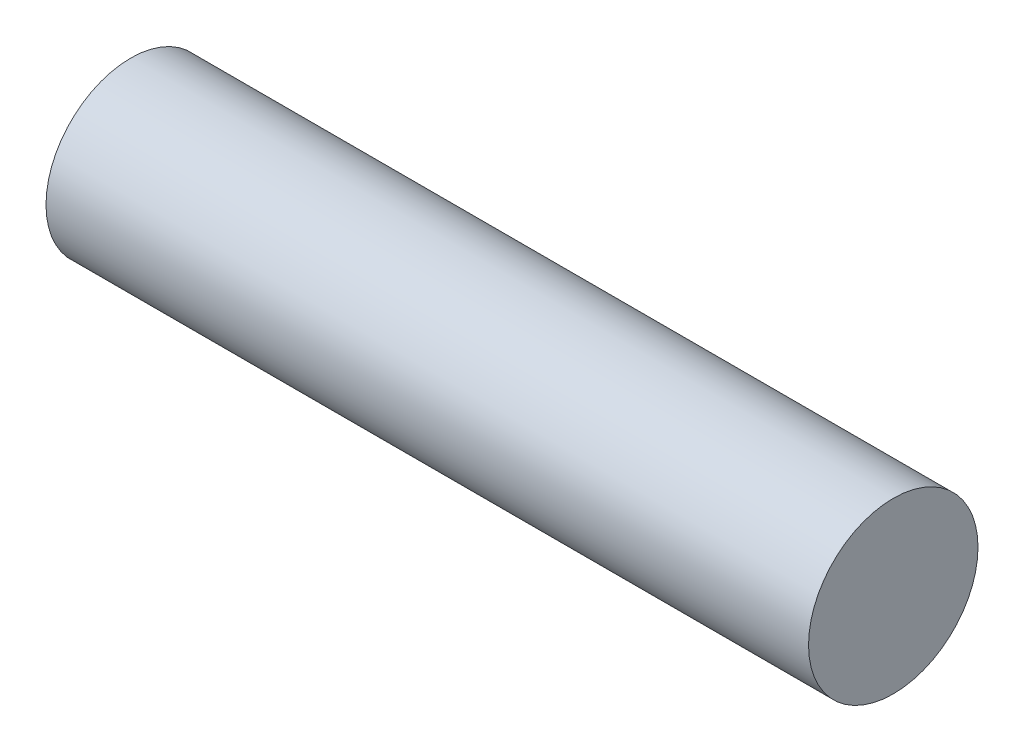
from build123d import *

# Parameters (mm, degrees)
SKETCH1_R           = 6.35
BOSS_EXTRUDE1_DEPTH = 28.575


with BuildPart() as part:
    # Sketch1 → Boss-Extrude1 (new, symmetric)
    with BuildSketch(Plane(origin=(0, 0, 0), x_dir=(0, 0, -1), z_dir=(1, 0, 0))):
        Circle(SKETCH1_R)
    extrude(amount=BOSS_EXTRUDE1_DEPTH, both=True)


solid = part.part
